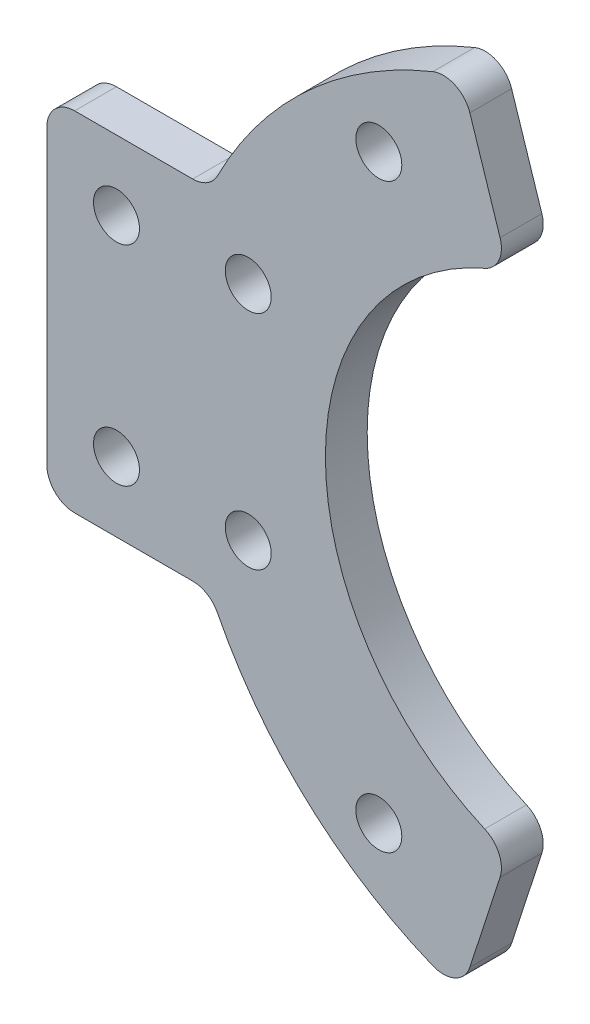
from build123d import *

# Parameters (mm, degrees)
SKETCH1_R           = 3.3
BOSS_EXTRUDE1_DEPTH = 6


with BuildPart() as part:
    # Sketch1 → Boss-Extrude1 (new body)
    with BuildSketch(Plane.XY):
        with BuildLine():
            Line((-17.260749948, 53.123125955), (-12.919719305, 39.762807409))
            ThreePointArc((-12.919719305, 39.762807409), (-13.077398812, 36.882750928), (-15.131188668, 34.857526153))
            ThreePointArc((-15.131188668, 34.857526153), (-38, 0), (-15.131188668, -34.857526153))
            ThreePointArc((-15.131188668, -34.857526153), (-13.077398812, -36.882750928), (-12.919719305, -39.762807409))
            Line((-12.919719305, -39.762807409), (-17.260749948, -53.123125955))
            ThreePointArc((-17.260749948, -53.123125955), (-19.377542011, -55.513704705), (-22.569617157, -55.593276404))
            ThreePointArc((-22.569617157, -55.593276404), (-40.59393325, -44.182944485), (-53.486819346, -27.1875))
            ThreePointArc((-53.486819346, -27.1875), (-54.960957236, -25.590454576), (-57.052607302, -25))
            Line((-57.052607302, -25), (-74, -25))
            ThreePointArc((-74, -25), (-76.828427125, -23.828427125), (-78, -21))
            Line((-78, -21), (-78, 21))
            ThreePointArc((-78, 21), (-76.828427125, 23.828427125), (-74, 25))
            Line((-74, 25), (-57.052607302, 25))
            ThreePointArc((-57.052607302, 25), (-54.960957236, 25.590454576), (-53.486819346, 27.1875))
            ThreePointArc((-53.486819346, 27.1875), (-40.59393325, 44.182944485), (-22.569617157, 55.593276404))
            ThreePointArc((-22.569617157, 55.593276404), (-19.377542011, 55.513704705), (-17.260749948, 53.123125955))
        make_face()
        with Locations((-30.329719018, -41.74527691)):
            Circle(SKETCH1_R, mode=Mode.SUBTRACT)
        with Locations((-49.074516241, -15.94527691)):
            Circle(SKETCH1_R, mode=Mode.SUBTRACT)
        with Locations((-49.074516241, 15.94527691)):
            Circle(SKETCH1_R, mode=Mode.SUBTRACT)
        with Locations((-30.329719018, 41.74527691)):
            Circle(SKETCH1_R, mode=Mode.SUBTRACT)
        with Locations((-68, 15)):
            Circle(SKETCH1_R, mode=Mode.SUBTRACT)
        with Locations((-68, -15)):
            Circle(SKETCH1_R, mode=Mode.SUBTRACT)
    extrude(amount=BOSS_EXTRUDE1_DEPTH)


solid = part.part
